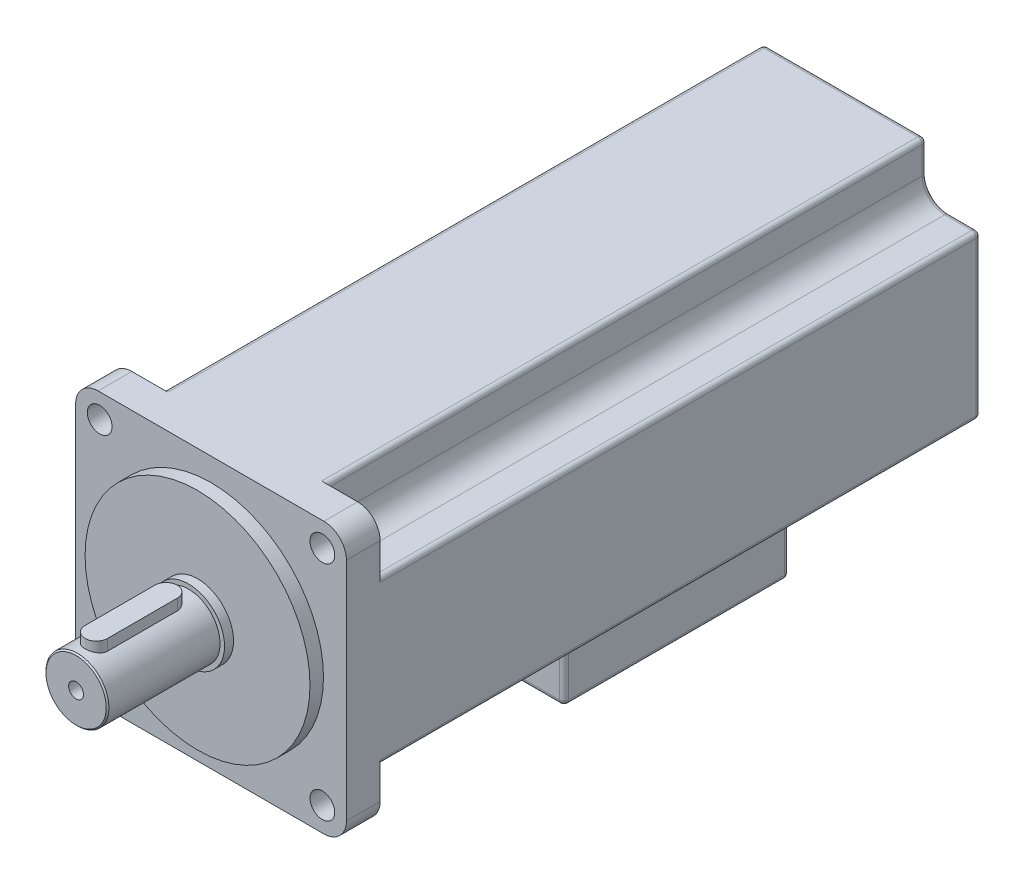
from build123d import *

# Parameters (mm, degrees)
SKETCH_1_W             = 60.2
SKETCH_1_H             = 60.2
EXTRUDE_1_DEPTH        = 7.5
FILLET_1_R             = 5
SKETCH_2_R             = 2.75
CUT_EXTRUDE_1_DEPTH    = 44.223488985
SKETCH_3_R             = 25
EXTRUDE_2_DEPTH        = 3
SKETCH_4_R             = 8
EXTRUDE_3_DEPTH        = 2
SKETCH_5_R             = 7
EXTRUDE_4_DEPTH        = 25
HOLE_WIZARD_M4_2_D     = 3.3
HOLE_WIZARD_M4_2_DEPTH = 10.1
HOLE_WIZARD_M4_2_TIP   = 0.991420021
CHAMFER_1_SIZE         = 0.3
EXTRUDE_5_DEPTH        = 5
EXTRUDE_6_DEPTH        = 133.5
FILLET_2_R             = 5
SKETCH_13_W            = 15
SKETCH_13_H            = 50
EXTRUDE_7_DEPTH        = 20
FILLET_3_R             = 1


with BuildPart() as part:
    # 草图1 → 凸台-拉伸1 (new body)
    with BuildSketch(Plane.XY):
        Rectangle(SKETCH_1_W, SKETCH_1_H)
    extrude(amount=EXTRUDE_1_DEPTH)

    # 圆角1
    fillet_1_edges = [part.edges().sort_by_distance(p)[0] for p in [
        (30.1, -30.1, 3.75),
        (-30.1, -30.1, 3.75),
        (-30.1, 30.1, 3.75),
        (30.1, 30.1, 3.75),
    ]]
    fillet(fillet_1_edges, radius=FILLET_1_R)

    # 草图2 → 切除-拉伸1 (cut, through all)
    with BuildSketch(Plane.XY.offset(7.5)):
        with Locations((-24.748737342, 24.748737342)):
            Circle(SKETCH_2_R)
        with Locations((24.748737342, 24.748737342)):
            Circle(SKETCH_2_R)
        with Locations((24.748737342, -24.748737342)):
            Circle(SKETCH_2_R)
        with Locations((-24.748737342, -24.748737342)):
            Circle(SKETCH_2_R)
    extrude(amount=-CUT_EXTRUDE_1_DEPTH, mode=Mode.SUBTRACT)

    # 草图3 → 凸台-拉伸2 (add)
    with BuildSketch(Plane.XY.offset(7.5)):
        with Locations(Location((0, 0, 0), (0, 0, 180))):
            Circle(SKETCH_3_R)
    extrude(amount=EXTRUDE_2_DEPTH)

    # 草图4 → 凸台-拉伸3 (add)
    with BuildSketch(Plane.XY.offset(10.5)):
        Circle(SKETCH_4_R)
    extrude(amount=EXTRUDE_3_DEPTH)

    # 草图5 → 凸台-拉伸4 (add)
    with BuildSketch(Plane.XY.offset(12.5)):
        Circle(SKETCH_5_R)
    extrude(amount=EXTRUDE_4_DEPTH)

    # M4 螺纹孔2
    with Locations(Plane.XY.offset(37.5)):
        with Locations((0, 0)):
            Hole(HOLE_WIZARD_M4_2_D / 2, depth=HOLE_WIZARD_M4_2_DEPTH)
            with Locations((0, 0, -(HOLE_WIZARD_M4_2_DEPTH + HOLE_WIZARD_M4_2_TIP / 2))):  # 118° drill point
                Cone(0, HOLE_WIZARD_M4_2_D / 2, HOLE_WIZARD_M4_2_TIP, mode=Mode.SUBTRACT)

    # 倒角1
    chamfer_1_edges = [part.edges().sort_by_distance(p)[0] for p in [
        (-7, 0, 37.5),
    ]]
    chamfer(chamfer_1_edges, length=CHAMFER_1_SIZE)

    # 草图10 → 凸台-拉伸5 (add)
    with BuildSketch(Plane(origin=(0, 9, 0), x_dir=(1, 0, 0), z_dir=(0, 1, 0))):
        with BuildLine():
            Line((-2.5, -33), (-2.5, -17.5))
            ThreePointArc((-2.5, -17.5), (0, -15), (2.5, -17.5))
            Line((2.5, -17.5), (2.5, -33))
            ThreePointArc((2.5, -33), (0, -35.5), (-2.5, -33))
        make_face()
    extrude(amount=-EXTRUDE_5_DEPTH)

    # 草图12 → 凸台-拉伸6 (add)
    with BuildSketch(Plane(origin=(0, 0, 0), x_dir=(-1, 0, 0), z_dir=(0, 0, -1))):
        Polygon((30.1, -18.1), (18.1, -18.1), (18.1, -30.1), (-18.1, -30.1), (-18.1, -18.1), (-30.1, -18.1), (-30.1, 18.1), (-18.1, 18.1), (-18.1, 30.1), (18.1, 30.1), (18.1, 18.1), (30.1, 18.1), align=None)
    extrude(amount=EXTRUDE_6_DEPTH)

    # 圆角2
    fillet_2_edges = [part.edges().sort_by_distance(p)[0] for p in [
        (-18.1, 18.1, -66.75),
        (18.1, 18.1, -66.75),
        (18.1, -18.1, -66.75),
        (-18.1, -18.1, -66.75),
    ]]
    fillet(fillet_2_edges, radius=FILLET_2_R)

    # 草图13 → 凸台-拉伸7 (add)
    with BuildSketch(Plane.XZ.offset(30.1)):
        with Locations((0, -88.5)):
            Rectangle(SKETCH_13_W, SKETCH_13_H)
    extrude(amount=EXTRUDE_7_DEPTH)

    # 圆角3
    fillet_3_edges = [part.edges().sort_by_distance(p)[0] for p in [
        (-30.1, -18.1, -66.75),
        (-30.1, 18.1, -66.75),
        (-18.1, 30.1, -66.75),
        (18.1, 30.1, -66.75),
        (30.1, 18.1, -66.75),
        (30.1, -18.1, -66.75),
        (18.1, -30.1, -66.75),
        (-18.1, -30.1, -66.75),
        (-30.1, 0, -133.5),
        (-26.6, 18.1, -133.5),
        (0, 30.1, -133.5),
        (18.1, 26.6, -133.5),
        (30.1, 0, -133.5),
        (26.6, -18.1, -133.5),
        (0, -30.1, -133.5),
        (-18.1, -26.6, -133.5),
        (-26.6, -18.1, -133.5),
        (-18.1, 26.6, -133.5),
        (26.6, 18.1, -133.5),
        (18.1, -26.6, -133.5),
        (-19.564466094, -19.564466094, -133.5),
        (-19.564466094, 19.564466094, -133.5),
        (19.564466094, 19.564466094, -133.5),
        (19.564466094, -19.564466094, -133.5),
        (-7.5, -40.1, -63.5),
        (-7.5, -40.1, -113.5),
        (7.5, -40.1, -113.5),
        (7.5, -40.1, -63.5),
        (-7.5, -50.1, -88.5),
        (0, -50.1, -113.5),
        (7.5, -50.1, -88.5),
        (0, -50.1, -63.5),
    ]]
    fillet(fillet_3_edges, radius=FILLET_3_R)


solid = part.part
